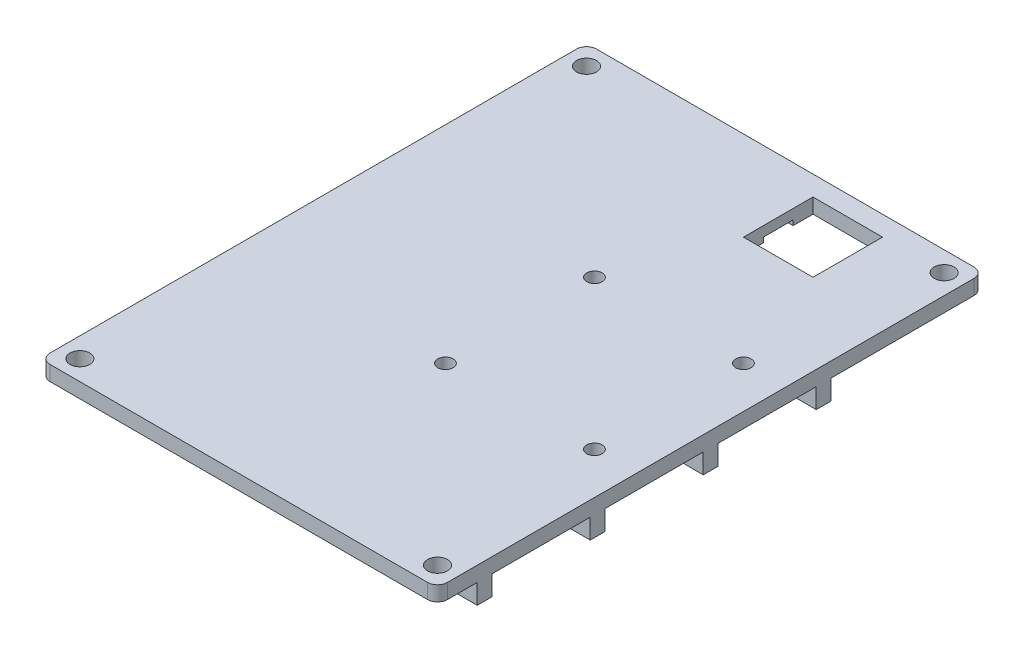
from build123d import *

# Parameters (mm, degrees)
EXTRUDE_1_DEPTH      = 12
CUT_EXTRUDE_1_DEPTH  = 12
SKETCH_3_R           = 2
CUT_EXTRUDE_2_DEPTH  = 12
CUT_EXTRUDE_3_DEPTH  = 1
SKETCH_5_W           = 80
SKETCH_5_H           = 4
CUT_EXTRUDE_4_DEPTH  = 20
EXTRUDE_2_DEPTH      = 1
SKETCH_7_W           = 0.2
SKETCH_7_H           = 8
CUT_EXTRUDE_5_DEPTH  = 1
SKETCH_8_R           = 2
EXTRUDE_3_DEPTH      = 4
SKETCH_9_W           = 80
SKETCH_9_H           = 9
CUT_EXTRUDE_6_DEPTH  = 14
SKETCH_10_W          = 9.44
SKETCH_10_H          = 1
CUT_EXTRUDE_7_DEPTH  = 14
SKETCH_11_W          = 9.44
SKETCH_11_H          = 1
EXTRUDE_4_DEPTH      = 8
CUT_EXTRUDE_8_DEPTH  = 8
SKETCH_13_W          = 80
SKETCH_13_H          = 3
EXTRUDE_5_DEPTH      = 7
SKETCH_14_R          = 1.6
EXTRUDE_7_DEPTH      = 3
SKETCH_16_W          = 3
SKETCH_16_H          = 4
EXTRUDE_8_DEPTH      = 80
SKETCH_17_R          = 1.55
CUT_EXTRUDE_11_DEPTH = 7
SKETCH_21_R          = 2
CUT_EXTRUDE_12_DEPTH = 7
EXTRUDE_9_DEPTH      = 4
SKETCH_23_W          = 3
SKETCH_23_H          = 4
CUT_EXTRUDE_13_DEPTH = 200
CUT_EXTRUDE_15_DEPTH = 5
SKETCH_25_W          = 9.44
SKETCH_25_H          = 4
CUT_EXTRUDE_16_DEPTH = 5
SKETCH_26_W          = 9.44
SKETCH_26_H          = 4
EXTRUDE_10_DEPTH     = 2
SKETCH_27_W          = 9.44
SKETCH_27_H          = 4
EXTRUDE_11_DEPTH     = 1
SKETCH_28_W          = 5
SKETCH_28_H          = 14
CUT_EXTRUDE_17_DEPTH = 1
SKETCH_29_W          = 5
SKETCH_29_H          = 4
EXTRUDE_12_DEPTH     = 1


with BuildPart() as part:
    # 草图1 → 凸台-拉伸1 (new body)
    with BuildSketch(Plane(origin=(0, 0, 0), x_dir=(1, 0, 0), z_dir=(0, 1, 0))):
        Polygon((-40, -6), (0, -6), (40, -6), (40, 0), (40, 6), (0, 6), (-36, 6), (-40, 6), align=None)
    extrude(amount=EXTRUDE_1_DEPTH)

    # 草图2 → 切除-拉伸1 (cut)
    with BuildSketch(Plane.XY.offset(6)):
        Polygon((-28, 0), (0, 0), (28, 0), (28, 4), (28, 8), (-28, 8), (-28, 4), align=None)
        Polygon((-40, 4), (-32, 4), (-32, 8), (-32, 12), (-40, 12), align=None)
        Polygon((32, 8), (32, 4), (40, 4), (40, 12), (32, 12), align=None)
    extrude(amount=-CUT_EXTRUDE_1_DEPTH, mode=Mode.SUBTRACT)

    # 草图3 → 切除-拉伸2 (cut)
    with BuildSketch(Plane(origin=(0, 12, 0), x_dir=(1, 0, 0), z_dir=(0, 1, 0))):
        with BuildLine():
            Line((-40, 6), (-40, 4))
            ThreePointArc((-40, 4), (-39.414213562, 5.414213562), (-38, 6))
            Line((-38, 6), (-40, 6))
        make_face()
        with Locations(Location((-36, 2, 0), (0, 0, 270))):
            Circle(SKETCH_3_R)
        with BuildLine():
            ThreePointArc((40, 4), (39.414213562, 5.414213562), (38, 6))
            Line((38, 6), (40, 6))
            Line((40, 6), (40, 4))
        make_face()
        with Locations(Location((36, 2, 0), (0, 0, 270))):
            Circle(SKETCH_3_R)
    extrude(amount=-CUT_EXTRUDE_2_DEPTH, mode=Mode.SUBTRACT)

    # 草图4 → 切除-拉伸3 (cut)
    with BuildSketch(Plane(origin=(0, 12, 0), x_dir=(1, 0, 0), z_dir=(0, 1, 0))):
        Polygon((-21.1, 0), (-21.1, 6), (-16.6, 6), (-12.1, 6), (12.08, 6), (16.6, 6), (21.12, 6), (21.12, -1), (21.12, -6), (16.6, -6), (12.08, -6), (12.08, -1), (12.08, 0), (-12.1, 0), (-12.1, -6), (-16.6, -6), (-21.1, -6), align=None)
    extrude(amount=-CUT_EXTRUDE_3_DEPTH, mode=Mode.SUBTRACT)

    # 草图5 → 切除-拉伸4 (cut)
    with BuildSketch(Plane(origin=(0, 12, 0), x_dir=(1, 0, 0), z_dir=(0, 1, 0))):
        with Locations((0, -4)):
            Rectangle(SKETCH_5_W, SKETCH_5_H)
    extrude(amount=-CUT_EXTRUDE_4_DEPTH, mode=Mode.SUBTRACT)

    # 草图6 → 凸台-拉伸2 (add)
    with BuildSketch(Plane(origin=(0, 12, 0), x_dir=(1, 0, 0), z_dir=(0, 1, 0))):
        Polygon((12.08, 0), (12.08, 6), (-21.1, 6), (-21.1, -2), (-12.1, -2), (-12.1, 0), align=None)
    extrude(amount=-EXTRUDE_2_DEPTH)

    # 草图7 → 切除-拉伸5 (cut)
    with BuildSketch(Plane(origin=(0, 12, 0), x_dir=(1, 0, 0), z_dir=(0, 1, 0))):
        with Locations((21.22, 2)):
            Rectangle(SKETCH_7_W, SKETCH_7_H)
        with Locations((11.98, 2)):
            Rectangle(SKETCH_7_W, SKETCH_7_H)
    extrude(amount=-CUT_EXTRUDE_5_DEPTH, mode=Mode.SUBTRACT)

    # 草图8 → 凸台-拉伸3 (add)
    # profile 1 of 2: a face of its own
    with BuildSketch(Plane(origin=(0, 12, 0), x_dir=(1, 0, 0), z_dir=(0, 1, 0))):
        with BuildLine():
            Line((-32, -2), (-40, -2))
            Line((-40, -2), (-40, 4))
            ThreePointArc((-40, 4), (-39.414213562, 5.414213562), (-38, 6))
            Line((-38, 6), (-32, 6))
            Line((-32, 6), (-32, -2))
        make_face()
        with Locations(Location((-36, 2, 0), (0, 0, 270))):
            Circle(SKETCH_8_R, mode=Mode.SUBTRACT)
    # profile 2 of 2: a face of its own
    with BuildSketch(Plane(origin=(0, 12, 0), x_dir=(1, 0, 0), z_dir=(0, 1, 0))):
        with BuildLine():
            Line((32, -2), (40, -2))
            Line((40, -2), (40, 4))
            ThreePointArc((40, 4), (39.414213562, 5.414213562), (38, 6))
            Line((38, 6), (32, 6))
            Line((32, 6), (32, -2))
        make_face()
        with Locations(Location((36, 2, 0), (0, 0, 270))):
            Circle(SKETCH_8_R, mode=Mode.SUBTRACT)
    extrude(amount=-EXTRUDE_3_DEPTH)

    # 草图9 → 切除-拉伸6 (cut)
    with BuildSketch(Plane.XY.offset(2)):
        with Locations((0, 4.5)):
            Rectangle(SKETCH_9_W, SKETCH_9_H)
    extrude(amount=-CUT_EXTRUDE_6_DEPTH, mode=Mode.SUBTRACT)

    # 草图10 → 切除-拉伸7 (cut)
    with BuildSketch(Plane(origin=(0, 0, -6), x_dir=(-1, 0, 0), z_dir=(0, 0, -1))):
        with Locations((-16.6, 9.5)):
            Rectangle(SKETCH_10_W, SKETCH_10_H)
    extrude(amount=-CUT_EXTRUDE_7_DEPTH, mode=Mode.SUBTRACT)

    # 草图11 → 凸台-拉伸4 (add)
    with BuildSketch(Plane(origin=(0, 0, -6), x_dir=(-1, 0, 0), z_dir=(0, 0, -1))):
        with Locations((-16.6, 11.5)):
            Rectangle(SKETCH_11_W, SKETCH_11_H)
    extrude(amount=-EXTRUDE_4_DEPTH)

    # 草图12 → 切除-拉伸8 (cut)
    with BuildSketch(Plane.XZ.offset(-9)):
        with BuildLine():
            ThreePointArc((21.05, -2.72), (18.302941274, 1.39126392), (13.453374824, 0.426625176))
            Line((13.453374824, 0.426625176), (19.746625176, -5.866625176))
            ThreePointArc((19.746625176, -5.866625176), (20.71126392, -4.422941274), (21.05, -2.72))
        make_face()
        with BuildLine():
            Line((19.746625176, -5.866625176), (13.453374824, 0.426625176))
            ThreePointArc((13.453374824, 0.426625176), (13.453374824, -5.866625176), (19.746625176, -5.866625176))
        make_face()
    extrude(amount=-CUT_EXTRUDE_8_DEPTH, mode=Mode.SUBTRACT)

    # 草图13 → 凸台-拉伸5 (add)
    with BuildSketch(Plane(origin=(0, 12, 0), x_dir=(1, 0, 0), z_dir=(0, 1, 0))):
        with Locations((0, -3.5)):
            Rectangle(SKETCH_13_W, SKETCH_13_H)
    extrude(amount=-EXTRUDE_5_DEPTH)

    # 草图14 → 凸台-拉伸7 (add)
    with BuildSketch(Plane(origin=(0, 12, 0), x_dir=(1, 0, 0), z_dir=(0, 1, 0))):
        with BuildLine():
            Line((-40, -100), (-40, -5))
            Line((-40, -5), (40, -5))
            Line((40, -5), (40, -100))
            Line((40, -100), (40, -102))
            ThreePointArc((40, -102), (39.414213562, -103.414213562), (38, -104))
            Line((38, -104), (36, -104))
            Line((36, -104), (-36, -104))
            Line((-36, -104), (-38, -104))
            ThreePointArc((-38, -104), (-39.414213562, -103.414213562), (-40, -102))
            Line((-40, -102), (-40, -100))
        make_face()
        with Locations(Location((-36, -100, 0), (0, 0, 270))):
            Circle(SKETCH_14_R, mode=Mode.SUBTRACT)
        with Locations(Location((36, -100, 0), (0, 0, 270))):
            Circle(SKETCH_14_R, mode=Mode.SUBTRACT)
    extrude(amount=-EXTRUDE_7_DEPTH)

    # 草图16 → 凸台-拉伸8 (add)
    with BuildSketch(Plane.ZY.offset(40)):
        with Locations((94.5, 7)):
            Rectangle(SKETCH_16_W, SKETCH_16_H)
    extrude(amount=-EXTRUDE_8_DEPTH)

    # 草图17 → 切除-拉伸11 (cut)
    with BuildSketch(Plane(origin=(0, 12, 0), x_dir=(1, 0, 0), z_dir=(0, 1, 0))):
        with Locations(Location((1.6, -34, 0), (0, 0, 270))):
            Circle(SKETCH_17_R)
        with Locations(Location((31.6, -34, 0), (0, 0, 270))):
            Circle(SKETCH_17_R)
        with Locations(Location((31.6, -64, 0), (0, 0, 270))):
            Circle(SKETCH_17_R)
        with Locations(Location((1.6, -64, 0), (0, 0, 270))):
            Circle(SKETCH_17_R)
    extrude(amount=-CUT_EXTRUDE_11_DEPTH, mode=Mode.SUBTRACT)

    # 草图21 → 切除-拉伸12 (cut)
    with BuildSketch(Plane(origin=(0, 12, 0), x_dir=(1, 0, 0), z_dir=(0, 1, 0))):
        with Locations(Location((-36, -100, 0), (0, 0, 270))):
            Circle(SKETCH_21_R)
        with Locations(Location((36, -100, 0), (0, 0, 270))):
            Circle(SKETCH_21_R)
    extrude(amount=-CUT_EXTRUDE_12_DEPTH, mode=Mode.SUBTRACT)

    # 草图22 → 凸台-拉伸9 (add)
    with BuildSketch(Plane(origin=(0, 9, 0), x_dir=(-1, 0, 0), z_dir=(0, -1, 0))):
        Polygon((40, -49), (40, -50.5), (-40, -50.5), (-40, -49), (-40, -47.5), (40, -47.5), align=None)
        Polygon((40, -26.25), (40, -27.75), (-40, -27.75), (-40, -24.75), (40, -24.75), align=None)
        Polygon((-40, -71.75), (-40, -73.25), (40, -73.25), (40, -70.25), (-40, -70.25), align=None)
    extrude(amount=EXTRUDE_9_DEPTH)

    # 草图23 → 切除-拉伸13 (cut)
    with BuildSketch(Plane.ZY.offset(40)):
        with Locations((3.5, 7)):
            Rectangle(SKETCH_23_W, SKETCH_23_H)
    extrude(amount=-CUT_EXTRUDE_13_DEPTH, mode=Mode.SUBTRACT)

    # 草图24 → 切除-拉伸15 (cut)
    with BuildSketch(Plane.XZ.offset(-9)):
        Polygon((11.88, -2), (11.88, 2), (16.6, 2), (16.6, 12), (9.6, 12), (9.6, -2), align=None)
        Polygon((16.6, 12), (16.6, 2), (21.32, 2), (21.32, -2), (23.6, -2), (23.6, 12), align=None)
    extrude(amount=-CUT_EXTRUDE_15_DEPTH, mode=Mode.SUBTRACT)

    # 草图25 → 切除-拉伸16 (cut)
    with BuildSketch(Plane(origin=(0, 10, 0), x_dir=(-1, 0, 0), z_dir=(0, -1, 0))):
        with Locations((-16.6, 0)):
            Rectangle(SKETCH_25_W, SKETCH_25_H)
    extrude(amount=-CUT_EXTRUDE_16_DEPTH, mode=Mode.SUBTRACT)

    # 草图26 → 凸台-拉伸10 (add)
    with BuildSketch(Plane(origin=(0, 10, 0), x_dir=(-1, 0, 0), z_dir=(0, -1, 0))):
        with Locations((-16.6, 4)):
            Rectangle(SKETCH_26_W, SKETCH_26_H)
    extrude(amount=-EXTRUDE_10_DEPTH)

    # 草图27 → 凸台-拉伸11 (add)
    with BuildSketch(Plane.XZ.offset(-10)):
        with Locations((16.6, -4)):
            Rectangle(SKETCH_27_W, SKETCH_27_H)
    extrude(amount=EXTRUDE_11_DEPTH)

    # 草图28 → 切除-拉伸17 (cut)
    with BuildSketch(Plane.XZ.offset(-9)):
        with Locations((7.1, 5)):
            Rectangle(SKETCH_28_W, SKETCH_28_H)
        with Locations((26.1, 5)):
            Rectangle(SKETCH_28_W, SKETCH_28_H)
    extrude(amount=-CUT_EXTRUDE_17_DEPTH, mode=Mode.SUBTRACT)

    # 草图29 → 凸台-拉伸12 (add)
    with BuildSketch(Plane.XZ.offset(-10)):
        with Locations((7.1, 0)):
            Rectangle(SKETCH_29_W, SKETCH_29_H)
        with Locations((26.1, 10)):
            Rectangle(SKETCH_29_W, SKETCH_29_H)
        with Locations((26.1, 0)):
            Rectangle(SKETCH_29_W, SKETCH_29_H)
        with Locations((7.1, 10)):
            Rectangle(SKETCH_29_W, SKETCH_29_H)
    extrude(amount=EXTRUDE_12_DEPTH)


solid = part.part
